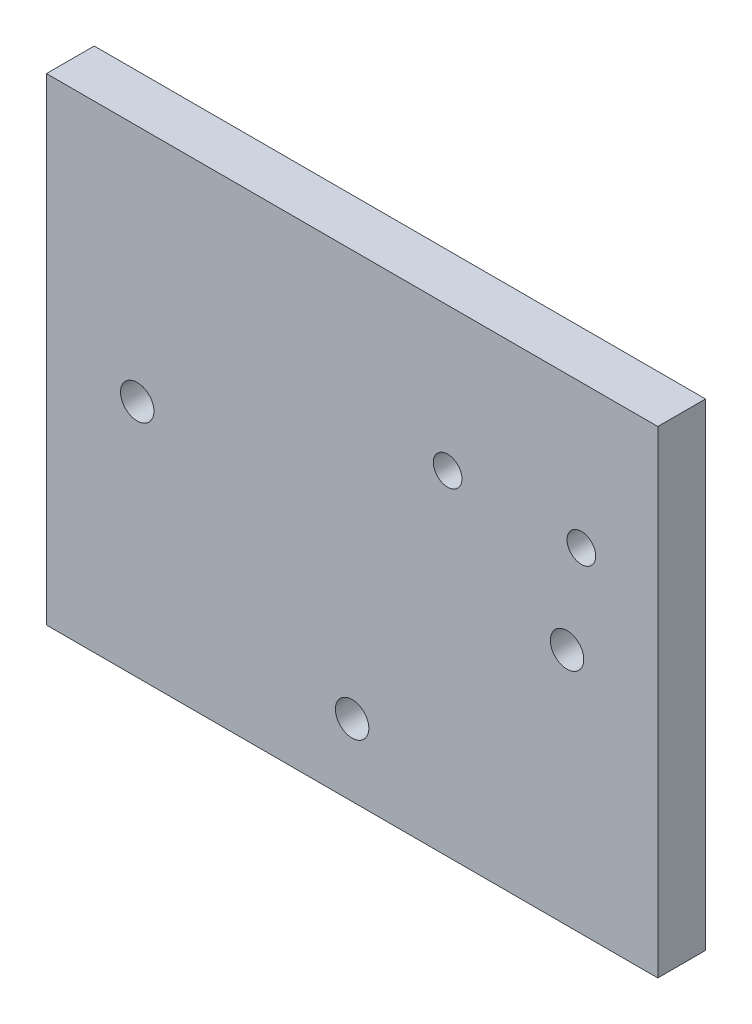
from build123d import *

# Parameters (mm, degrees)
SKETCH1_W           = 64
SKETCH1_H           = 50
SKETCH1_R           = 1.75
SKETCH1_R_2         = 1.5
BOSS_EXTRUDE1_DEPTH = 5


with BuildPart() as part:
    # Sketch1 → Boss-Extrude1 (new body)
    with BuildSketch(Plane.XY):
        Rectangle(SKETCH1_W, SKETCH1_H)
        with Locations((-22.5, 0)):
            Circle(SKETCH1_R, mode=Mode.SUBTRACT)
        with Locations((22.5, 0)):
            Circle(SKETCH1_R, mode=Mode.SUBTRACT)
        with Locations((0, -17.5)):
            Circle(SKETCH1_R, mode=Mode.SUBTRACT)
        with Locations((10, 10)):
            Circle(SKETCH1_R_2, mode=Mode.SUBTRACT)
        with Locations((24, 10)):
            Circle(SKETCH1_R_2, mode=Mode.SUBTRACT)
    extrude(amount=BOSS_EXTRUDE1_DEPTH)


solid = part.part
